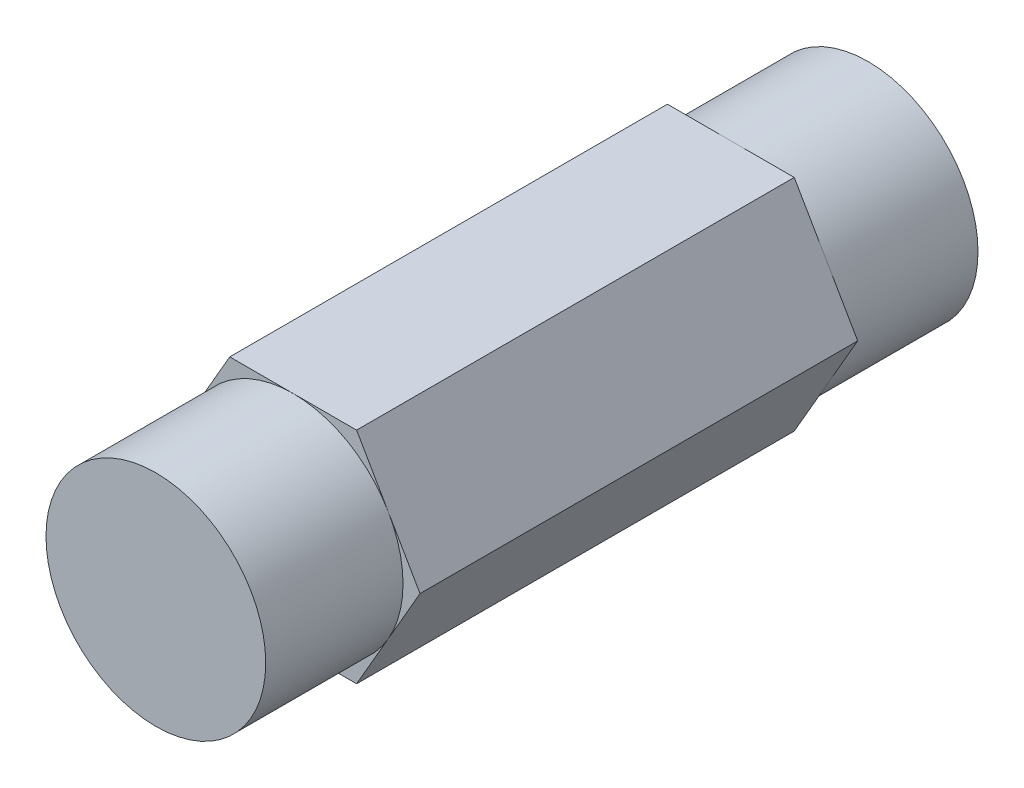
from build123d import *

# Parameters (mm, degrees)
SKETCH1_R           = 6.35
BOSS_EXTRUDE1_DEPTH = 7.9375
BOSS_EXTRUDE2_DEPTH = 25.2984
SKETCH3_R           = 6.35
BOSS_EXTRUDE3_DEPTH = 7.9375


with BuildPart() as part:
    # Sketch1 → Boss-Extrude1 (new body)
    with BuildSketch(Plane.XY):
        Circle(SKETCH1_R)
    extrude(amount=BOSS_EXTRUDE1_DEPTH)

    # Sketch2 → Boss-Extrude2 (add)
    with BuildSketch(Plane.XY.offset(7.9375)):
        Polygon((7.332348419, 0), (3.666174209, 6.35), (-3.666174209, 6.35), (-7.332348419, 0), (-3.666174209, -6.35), (3.666174209, -6.35), align=None)
    extrude(amount=BOSS_EXTRUDE2_DEPTH)

    # Sketch3 → Boss-Extrude3 (add)
    with BuildSketch(Plane.XY.offset(33.2359)):
        with Locations(Location((0, 0, 0), (0, 0, 150))):
            Circle(SKETCH3_R)
    extrude(amount=BOSS_EXTRUDE3_DEPTH)


solid = part.part
